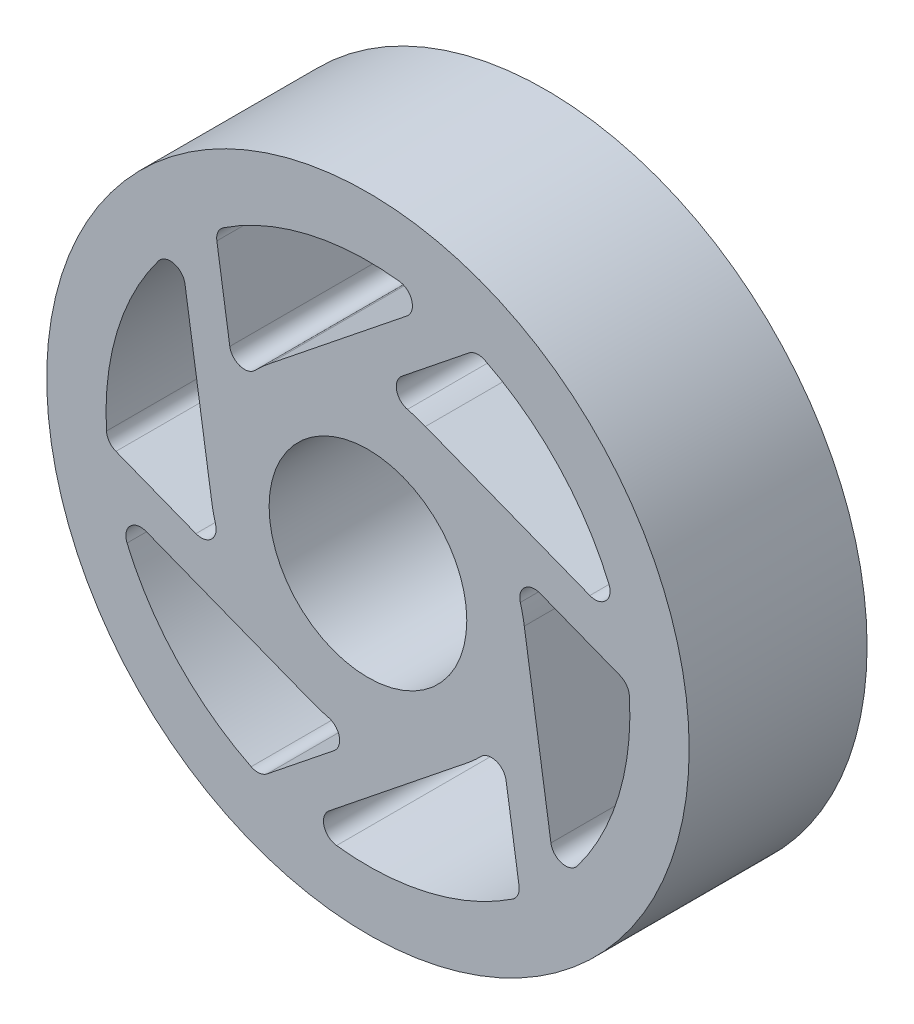
from build123d import *

# Parameters (mm, degrees)
SKETCH_1_R          = 32.5
SKETCH_1_R_2        = 5
EXTRUDE_1_DEPTH     = 9
SKETCH_2_R          = 10
CUT_EXTRUDE_2_DEPTH = 15
CUT_EXTRUDE_3_DEPTH = 45
FILLET_1_R          = 1.5


with BuildPart() as part:
    # 草图1 → 凸台-拉伸1 (new, symmetric)
    with BuildSketch(Plane.XY):
        Circle(SKETCH_1_R)
        Circle(SKETCH_1_R_2, mode=Mode.SUBTRACT)
    extrude(amount=EXTRUDE_1_DEPTH, both=True)

    # 草图2 → 切除-拉伸2 (cut)
    with BuildSketch(Plane.XY.offset(9)):
        Circle(SKETCH_2_R)
    extrude(amount=-CUT_EXTRUDE_2_DEPTH, mode=Mode.SUBTRACT)

    # 草图3 → 切除-拉伸3 (cut)
    with BuildSketch(Plane.XY.offset(9)):
        with BuildLine():
            ThreePointArc((-13.460032078, 8.65029112), (-11.886088914, 10.710783834), (-10, 12.489995997))
            Line((-10, 12.489995997), (6.490409144, 25.692889856))
            ThreePointArc((6.490409144, 25.692889856), (-4.927079416, 26.037931723), (-15.429116278, 21.545124063))
            Line((-15.429116278, 21.545124063), (-13.460032078, 8.65029112))
        make_face()
        with BuildLine():
            ThreePointArc((25.495899884, 7.225585728), (20.085970626, 17.285941802), (10.944066627, 24.134568686))
            Line((10.944066627, 24.134568686), (0.761355821, 15.981875275))
            ThreePointArc((0.761355821, 15.981875275), (3.332766438, 15.649046868), (5.816653826, 14.905252036))
            Line((5.816653826, 14.905252036), (25.495899884, 7.225585728))
        make_face()
        with BuildLine():
            ThreePointArc((26.5, 0), (26.468276738, 1.296274087), (26.373182905, 2.589444623))
            Line((26.373182905, 2.589444623), (14.221387899, 7.331584155))
            ThreePointArc((14.221387899, 7.331584155), (15.218855351, 4.938263034), (15.816653826, 2.415256039))
            Line((15.816653826, 2.415256039), (19.005490739, -18.467304128))
            ThreePointArc((19.005490739, -18.467304128), (24.554994447, -9.965051315), (26.5, 0))
        make_face()
        with BuildLine():
            Line((15.429116278, -21.545124063), (13.460032078, -8.65029112))
            ThreePointArc((13.460032078, -8.65029112), (11.886088914, -10.710783834), (10, -12.489995997))
            Line((10, -12.489995997), (-6.490409144, -25.692889856))
            ThreePointArc((-6.490409144, -25.692889856), (4.927079416, -26.037931723), (15.429116278, -21.545124063))
        make_face()
        with BuildLine():
            Line((-5.816653826, -14.905252036), (-25.495899884, -7.225585728))
            ThreePointArc((-25.495899884, -7.225585728), (-20.085970626, -17.285941802), (-10.944066627, -24.134568686))
            Line((-10.944066627, -24.134568686), (-0.761355821, -15.981875275))
            ThreePointArc((-0.761355821, -15.981875275), (-3.332766438, -15.649046868), (-5.816653826, -14.905252036))
        make_face()
        with BuildLine():
            Line((-15.816653826, -2.415256039), (-19.005490739, 18.467304128))
            ThreePointArc((-19.005490739, 18.467304128), (-25.013050042, 8.751989921), (-26.373182905, -2.589444623))
            Line((-26.373182905, -2.589444623), (-14.221387899, -7.331584155))
            ThreePointArc((-14.221387899, -7.331584155), (-15.218855351, -4.938263034), (-15.816653826, -2.415256039))
        make_face()
    extrude(amount=-CUT_EXTRUDE_3_DEPTH, mode=Mode.SUBTRACT)

    # 圆角1
    fillet_1_edges = [part.edges().sort_by_distance(p)[0] for p in [
        (-6.490409144, -25.692889856, 0),
        (13.460032078, -8.65029112, 0),
        (15.429116278, -21.545124063, 0),
        (-25.495899884, -7.225585728, 0),
        (-0.761355821, -15.981875275, 0),
        (-10.944066627, -24.134568686, 0),
        (25.495899884, 7.225585728, 0),
        (0.761355821, 15.981875275, 0),
        (10.944066627, 24.134568686, 0),
        (19.005490739, -18.467304128, 0),
        (14.221387899, 7.331584155, 0),
        (26.373182905, 2.589444623, 0),
        (-19.005490739, 18.467304128, 0),
        (-14.221387899, -7.331584155, 0),
        (-26.373182905, -2.589444623, 0),
        (6.490409144, 25.692889856, 0),
        (-13.460032078, 8.65029112, 0),
        (-15.429116278, 21.545124063, 0),
    ]]
    fillet(fillet_1_edges, radius=FILLET_1_R)


solid = part.part
